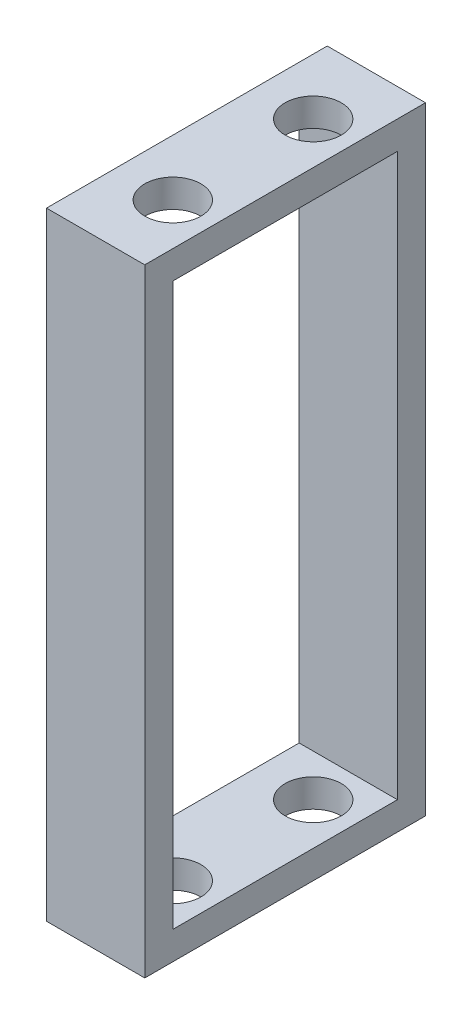
from build123d import *

# Parameters (mm, degrees)
EXTRUDE_1_DEPTH     = 10
SKETCH_2_W          = 16
SKETCH_2_H          = 40
CUT_EXTRUDE_1_DEPTH = 10
SKETCH_3_R          = 2
CUT_EXTRUDE_2_DEPTH = 50


with BuildPart() as part:
    # 草图1 → 凸台-拉伸1 (new, symmetric)
    with BuildSketch(Plane.XY):
        Polygon((0, 42), (0, 2), (0, 0), (7, 0), (7, 44), (0, 44), align=None)
    extrude(amount=EXTRUDE_1_DEPTH, both=True)

    # 草图2 → 切除-拉伸1 (cut, symmetric)
    with BuildSketch(Plane(origin=(7, 0, 0), x_dir=(0, 0, -1), z_dir=(1, 0, 0))):
        with Locations((0, 22)):
            Rectangle(SKETCH_2_W, SKETCH_2_H)
    extrude(amount=CUT_EXTRUDE_1_DEPTH, both=True, mode=Mode.SUBTRACT)

    # 草图3 → 切除-拉伸2 (cut)
    with BuildSketch(Plane(origin=(0, 44, 0), x_dir=(1, 0, 0), z_dir=(0, 1, 0))):
        with Locations(Location((4, 5, 0), (0, 0, 270))):
            Circle(SKETCH_3_R)
        with Locations(Location((4, -5, 0), (0, 0, 270))):
            Circle(SKETCH_3_R)
    extrude(amount=-CUT_EXTRUDE_2_DEPTH, mode=Mode.SUBTRACT)


solid = part.part
